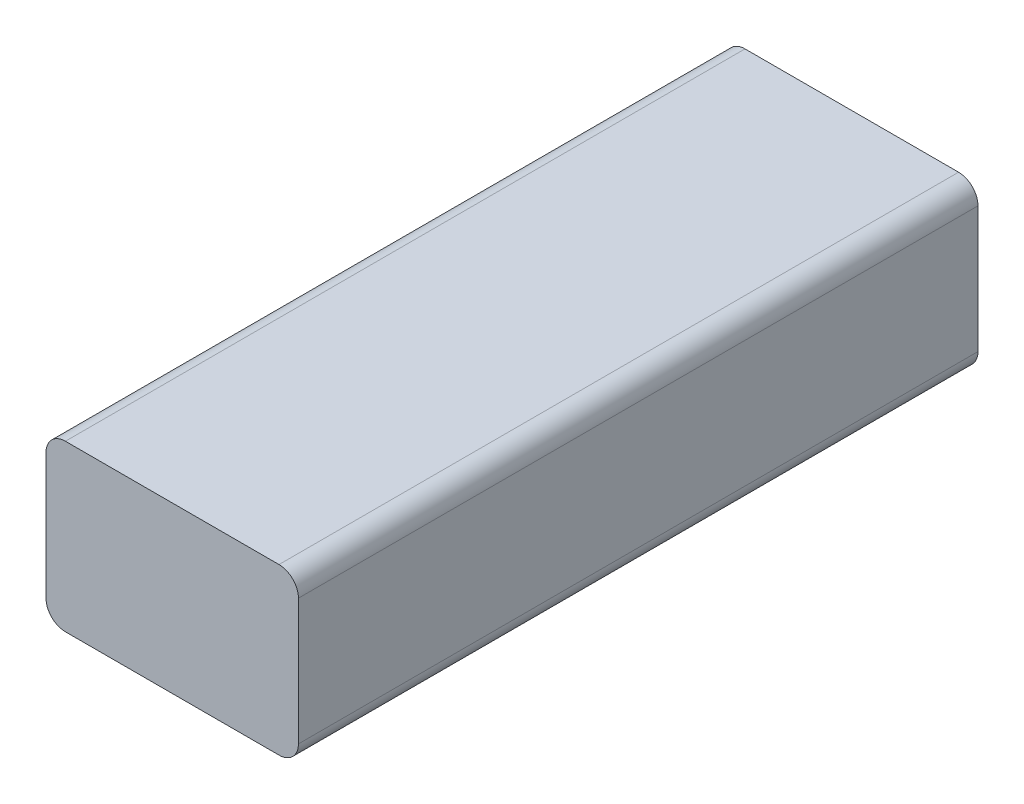
from build123d import *

# Parameters (mm, degrees)
DODANIE_WYCI_GNI_CIE1_DEPTH = 70


with BuildPart() as part:
    # Szkic1 → Dodanie-wyciągnięcie1 (new body)
    with BuildSketch(Plane.XY):
        with BuildLine():
            Line((-7.306410448, 7.115226337), (14.693589552, 7.115226337))
            ThreePointArc((14.693589552, 7.115226337), (16.107803115, 6.5294399), (16.693589552, 5.115226337))
            Line((16.693589552, 5.115226337), (16.693589552, -7.884773663))
            ThreePointArc((16.693589552, -7.884773663), (16.107803115, -9.298987225), (14.693589552, -9.884773663))
            Line((14.693589552, -9.884773663), (-7.306410448, -9.884773663))
            ThreePointArc((-7.306410448, -9.884773663), (-8.72062401, -9.298987225), (-9.306410448, -7.884773663))
            Line((-9.306410448, -7.884773663), (-9.306410448, 5.115226337))
            ThreePointArc((-9.306410448, 5.115226337), (-8.72062401, 6.5294399), (-7.306410448, 7.115226337))
        make_face()
    extrude(amount=DODANIE_WYCI_GNI_CIE1_DEPTH)


solid = part.part
